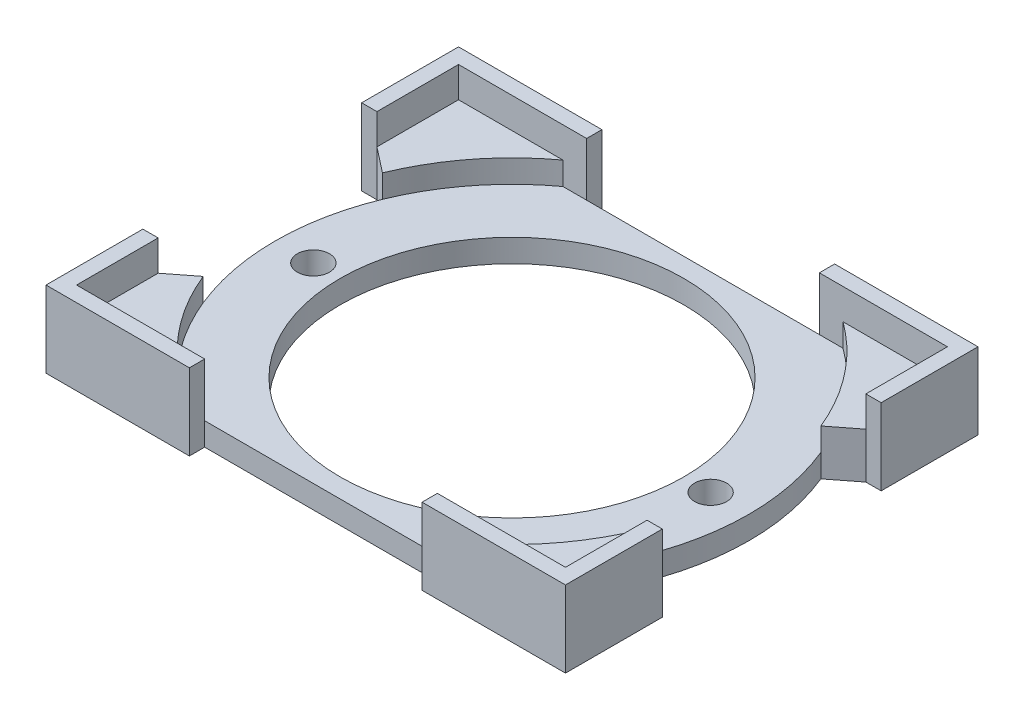
from build123d import *

# Parameters (mm, degrees)
BOSS_EXTRUDE1_DEPTH   = 10
BOSS_EXTRUDE1_2_DEPTH = 10
BOSS_EXTRUDE1_3_DEPTH = 10
BOSS_EXTRUDE1_4_DEPTH = 10
SKETCH1_9_R           = 22.5
SKETCH1_9_R_2         = 2.1
BOSS_EXTRUDE2_DEPTH   = 3
BOSS_EXTRUDE3_DEPTH   = 6


with BuildPart() as part:
    # Sketch1 → Boss-Extrude1 (new body)
    with BuildSketch(Plane(origin=(0, 0, 0), x_dir=(1, 0, 0), z_dir=(0, 1, 0))):
        Polygon((32, -14.320549047), (32, -25), (15.231546212, -25), (15.231546212, -27), (34, -27), (34, -14.320549047), align=None)
    extrude(amount=BOSS_EXTRUDE1_DEPTH)



with BuildPart() as body_2:
    # Sketch1 → Boss-Extrude1 2 (new body)
    with BuildSketch(Plane(origin=(0, 0, 0), x_dir=(1, 0, 0), z_dir=(0, 1, 0))):
        Polygon((32, 25), (32, 14.320549047), (34, 14.320549047), (34, 27), (15.231546212, 27), (15.231546212, 25), align=None)
    extrude(amount=BOSS_EXTRUDE1_2_DEPTH)


with BuildPart() as body_3:
    # Sketch1 → Boss-Extrude1 3 (new body)
    with BuildSketch(Plane(origin=(0, 0, 0), x_dir=(1, 0, 0), z_dir=(0, 1, 0))):
        Polygon((-15.231546212, -27), (-15.231546212, -25), (-32, -25), (-32, -14.320549047), (-34, -14.320549047), (-34, -27), align=None)
    extrude(amount=BOSS_EXTRUDE1_3_DEPTH)


with BuildPart() as body_4:
    # Sketch1 → Boss-Extrude1 4 (new body)
    with BuildSketch(Plane(origin=(0, 0, 0), x_dir=(1, 0, 0), z_dir=(0, 1, 0))):
        Polygon((-32, 25), (-15.231546212, 25), (-15.231546212, 27), (-34, 27), (-34, 14.320549047), (-32, 14.320549047), align=None)
    extrude(amount=BOSS_EXTRUDE1_4_DEPTH)


with BuildPart() as part_1:
    add(part.part)

    add(body_2.part)  # Boss-Extrude2 merges body 2

    add(body_3.part)  # Boss-Extrude2 merges body 3

    add(body_4.part)  # Boss-Extrude2 merges body 4
    # Sketch1<9> → Boss-Extrude2 (add)
    with BuildSketch(Plane(origin=(0, 0, 0), x_dir=(1, 0, 0), z_dir=(0, 1, 0))):
        with BuildLine():
            Line((32, -25), (32, -14.320549047))
            Line((32, -14.320549047), (28.692414075, -11.736497543))
            ThreePointArc((28.692414075, -11.736497543), (31, 0), (28.692414075, 11.736497543))
            Line((28.692414075, 11.736497543), (32, 14.320549047))
            Line((32, 14.320549047), (32, 25))
            Line((32, 25), (-32, 25))
            Line((-32, 25), (-32, 14.320549047))
            Line((-32, 14.320549047), (-28.692414075, 11.736497543))
            ThreePointArc((-28.692414075, 11.736497543), (-31, 0), (-28.692414075, -11.736497543))
            Line((-28.692414075, -11.736497543), (-32, -14.320549047))
            Line((-32, -14.320549047), (-32, -25))
            Line((-32, -25), (32, -25))
        make_face()
        Circle(SKETCH1_9_R, mode=Mode.SUBTRACT)
        with Locations((26, 0)):
            Circle(SKETCH1_9_R_2, mode=Mode.SUBTRACT)
        with Locations((-26, 0)):
            Circle(SKETCH1_9_R_2, mode=Mode.SUBTRACT)
    extrude(amount=BOSS_EXTRUDE2_DEPTH)

    # Sketch1<11> → Boss-Extrude3 (add)
    with BuildSketch(Plane(origin=(0, 0, 0), x_dir=(1, 0, 0), z_dir=(0, 1, 0))):
        with BuildLine():
            Line((18.33030278, -25), (32, -25))
            Line((32, -25), (32, -14.320549047))
            Line((32, -14.320549047), (28.692414075, -11.736497543))
            ThreePointArc((28.692414075, -11.736497543), (24.428755585, -19.084965301), (18.33030278, -25))
        make_face()
        with BuildLine():
            Line((28.692414075, 11.736497543), (32, 14.320549047))
            Line((32, 14.320549047), (32, 25))
            Line((32, 25), (18.33030278, 25))
            ThreePointArc((18.33030278, 25), (24.428755585, 19.084965301), (28.692414075, 11.736497543))
        make_face()
        with BuildLine():
            Line((-32, -25), (-18.33030278, -25))
            ThreePointArc((-18.33030278, -25), (-24.428755585, -19.084965301), (-28.692414075, -11.736497543))
            Line((-28.692414075, -11.736497543), (-32, -14.320549047))
            Line((-32, -14.320549047), (-32, -25))
        make_face()
        with BuildLine():
            Line((-32, 25), (-32, 14.320549047))
            Line((-32, 14.320549047), (-28.692414075, 11.736497543))
            ThreePointArc((-28.692414075, 11.736497543), (-24.428755585, 19.084965301), (-18.33030278, 25))
            Line((-18.33030278, 25), (-32, 25))
        make_face()
    extrude(amount=BOSS_EXTRUDE3_DEPTH)


solid = part_1.part
